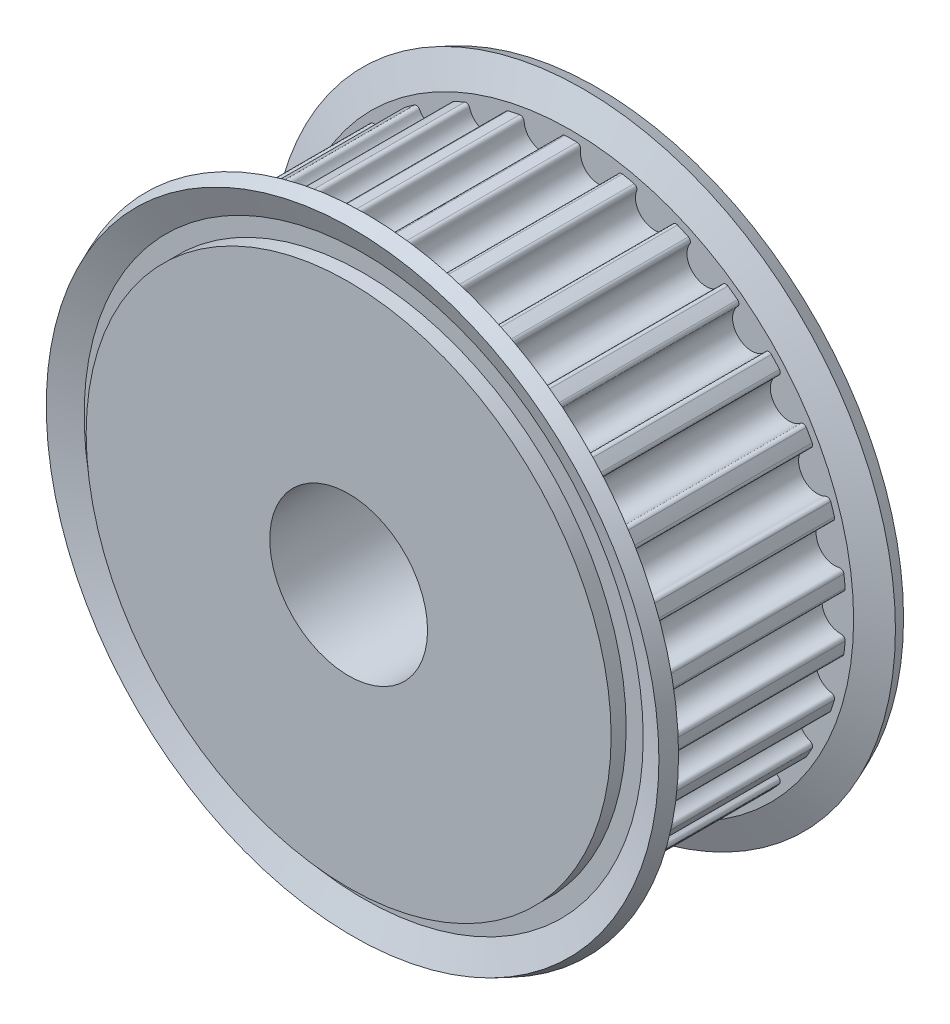
from build123d import *

# Parameters (mm, degrees)
TOOTHEXTRUDECUTGEARBELT01PULLEY_DEPTH = 4.876799927
PATTERNGEARBELT01PULLEY_COUNT         = 30
BOREREVOLVESKETCH_W                   = 12.801599808
BOREREVOLVESKETCH_H                   = 4


with BuildPart() as part:
    # SketchRevolveGearBelt01Pulley → GearBelt01Pulley (revolve)
    with BuildSketch(Plane(origin=(0, 0, 0), x_dir=(0, 0, -1), z_dir=(1, 0, 0))):
        Polygon((6.400799904, 0), (6.400799904, 13.306916417), (5.638799915, 13.306916417), (5.638799915, 14.17134518), (6.201536555, 15.529911608), (5.497540362, 15.821516379), (4.876799927, 14.322916402), (4.876799927, 13.941916408), (-4.876799927, 13.941916408), (-4.876799927, 14.322916402), (-5.497540362, 15.821516379), (-6.201536555, 15.529911608), (-5.638799915, 14.17134518), (-5.638799915, 13.306916417), (-6.400799904, 13.306916417), (-6.400799904, 0), align=None)
    revolve(axis=Axis((0, 0, 0), (0, 0, -1)))

    # SketchToothGearBelt01Pulley → ToothExtrudeCutGearBelt01Pulley (cut, symmetric)
    with BuildSketch(Plane.XY):
        with BuildLine():
            ThreePointArc((13.893477895, 1.162049767), (13.941990091, 0), (13.893477895, -1.162049767))
            add(Edge.make_bspline(
                [(13.893477895, -1.162049767), (13.894355497, -1.151569871), (13.894367328, -1.13574137), (13.891783851, -1.114849561), (13.88856033, -1.099393952), (13.884072736, -1.084256956), (13.878351699, -1.069541767), (13.871436211, -1.055348702), (13.863373419, -1.041774518), (13.854218288, -1.028911755), (13.844033233, -1.016848102), (13.832887687, -1.005665799), (13.820857633, -0.995441086), (13.808025082, -0.986243636), (13.794477517, -0.97813627), (13.780307299, -0.971173811), (13.765611019, -0.965405397), (13.750488906, -0.960864109), (13.735043897, -0.957604207), (13.719381867, -0.955560951), (13.690295039, -0.954660893), (13.642257342, -0.955570539), (13.575220239, -0.952960995), (13.502997829, -0.944194093), (13.431675895, -0.929863568), (13.361697972, -0.909971895), (13.293492773, -0.884664268), (13.227479874, -0.85409009), (13.164064907, -0.818438922), (13.10363766, -0.777929443), (13.046569525, -0.732810753), (12.993211261, -0.683360129), (12.943890814, -0.629881514), (12.898911329, -0.572703598), (12.858549229, -0.512177812), (12.823052703, -0.448676153), (12.792639493, -0.382588943), (12.767498123, -0.314322274), (12.747777154, -0.244296081), (12.733620052, -0.172939446), (12.725030771, -0.100695851), (12.723087585, -0.04755736), (12.723178891, -0.014000083), (12.723166194, 0), (12.723178891, 0.014000083), (12.723087585, 0.04755736), (12.725030771, 0.100695851), (12.733620052, 0.172939446), (12.747777154, 0.244296081), (12.767498123, 0.314322274), (12.792639493, 0.382588943), (12.823052703, 0.448676153), (12.858549229, 0.512177812), (12.898911329, 0.572703598), (12.943890814, 0.629881514), (12.993211261, 0.683360129), (13.046569525, 0.732810753), (13.10363766, 0.777929443), (13.164064907, 0.818438922), (13.227479874, 0.85409009), (13.293492773, 0.884664268), (13.361697972, 0.909971895), (13.431675895, 0.929863568), (13.502997829, 0.944194093), (13.575220239, 0.952960995), (13.642257342, 0.955570539), (13.690295039, 0.954660893), (13.719381867, 0.955560951), (13.735043897, 0.957604207), (13.750488906, 0.960864109), (13.765611019, 0.965405397), (13.780307299, 0.971173811), (13.794477517, 0.97813627), (13.808025082, 0.986243636), (13.820857633, 0.995441086), (13.832887687, 1.005665799), (13.844033233, 1.016848102), (13.854218288, 1.028911755), (13.863373419, 1.041774518), (13.871436211, 1.055348702), (13.878351699, 1.069541767), (13.884072736, 1.084256956), (13.88856033, 1.099393952), (13.891783851, 1.114849561), (13.894367328, 1.13574137), (13.894355497, 1.151569871), (13.893477895, 1.162049767)],
                knots=[0, 0, 0, 0, 0.008512506, 0.012768759, 0.017025012, 0.021281265, 0.025537518, 0.029793771, 0.034050023, 0.038306276, 0.042562529, 0.046818782, 0.051075035, 0.055331288, 0.059587541, 0.063843794, 0.068100047, 0.0723563, 0.076612553, 0.080868806, 0.085125059, 0.100157118, 0.119771414, 0.139385711, 0.159000007, 0.178614304, 0.1982286, 0.217842897, 0.237457193, 0.257071489, 0.276685786, 0.296300082, 0.315914379, 0.335528675, 0.355142972, 0.374757268, 0.394371565, 0.413985861, 0.433600158, 0.453214454, 0.472828751, 0.492443047, 0.496221523, 0.5, 0.503778477, 0.507556953, 0.527171249, 0.546785546, 0.566399842, 0.586014139, 0.605628435, 0.625242732, 0.644857028, 0.664471325, 0.684085621, 0.703699918, 0.723314214, 0.742928511, 0.762542807, 0.782157103, 0.8017714, 0.821385696, 0.840999993, 0.860614289, 0.880228586, 0.899842882, 0.914874941, 0.919131194, 0.923387447, 0.9276437, 0.931899953, 0.936156206, 0.940412459, 0.944668712, 0.948924965, 0.953181218, 0.957437471, 0.961693724, 0.965949977, 0.970206229, 0.974462482, 0.978718735, 0.982974988, 0.987231241, 0.991487494, 1, 1, 1, 1], degree=3))
        make_face()
    toothextrudecutgearbelt01pulley = extrude(amount=TOOTHEXTRUDECUTGEARBELT01PULLEY_DEPTH, both=True, mode=Mode.SUBTRACT)

    # PatternGearBelt01Pulley: ToothExtrudeCutGearBelt01Pulley ×30 about axis
    patterngearbelt01pulley_axis = Axis((0, 0, 55), (0, 0, -1))
    for i in range(1, PATTERNGEARBELT01PULLEY_COUNT):
        add(toothextrudecutgearbelt01pulley.rotate(patterngearbelt01pulley_axis, i * 360 / PATTERNGEARBELT01PULLEY_COUNT), mode=Mode.SUBTRACT)

    # BoreRevolveSketch → BoreRevolveCut (revolve, cut)
    with BuildSketch(Plane(origin=(0, 0, 0), x_dir=(0, 0, -1), z_dir=(1, 0, 0))):
        with Locations((0, 2)):
            Rectangle(BOREREVOLVESKETCH_W, BOREREVOLVESKETCH_H)
    revolve(axis=Axis((0, 0, 0), (0, 0, -1)), mode=Mode.SUBTRACT)


solid = part.part
